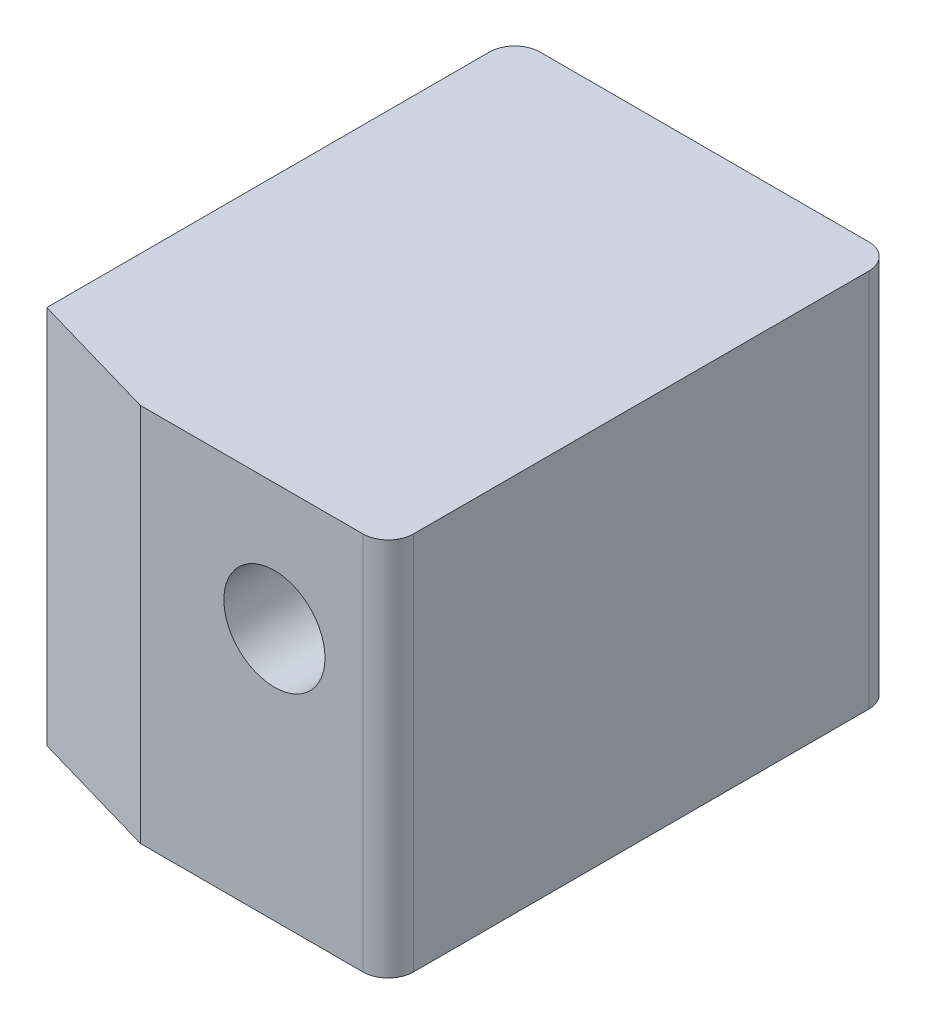
from build123d import *

# Parameters (mm, degrees)
BOSS_EXTRU_1_DEPTH      = 15
ESQUISSE2_R             = 2
ENL_V_MAT_EXTRU_1_DEPTH = 12
ESQUISSE3_R             = 2
ENL_V_MAT_EXTRU_2_DEPTH = 12
CONG_1_R                = 1
ENL_V_MAT_EXTRU_3_REACH = 28.101


with BuildPart() as part:
    # Esquisse1 → Boss.-Extru.1 (new body)
    with BuildSketch(Plane(origin=(0, 0, 0), x_dir=(1, 0, 0), z_dir=(0, 1, 0))):
        Polygon((0, 0), (7.5, 0), (7.5, 20), (-7.5, 20), (-7.5, 0), align=None)
    extrude(amount=BOSS_EXTRU_1_DEPTH)

    # Esquisse2 → Enlèv. mat.-Extru.1 (cut)
    with BuildSketch(Plane.XZ):
        with Locations(Location((3, -16, 0), (0, 0, 270))):
            Circle(ESQUISSE2_R)
        with Locations(Location((-3, -4, 0), (0, 0, 270))):
            Circle(ESQUISSE2_R)
    extrude(amount=-ENL_V_MAT_EXTRU_1_DEPTH, mode=Mode.SUBTRACT)

    # Esquisse3 → Enlèv. mat.-Extru.2 (cut)
    with BuildSketch(Plane.XY):
        with Locations((3, 10)):
            Circle(ESQUISSE3_R)
    extrude(amount=-ENL_V_MAT_EXTRU_2_DEPTH, mode=Mode.SUBTRACT)

    # Congé1
    cong_1_edges = [part.edges().sort_by_distance(p)[0] for p in [
        (-7.5, 7.5, -20),
        (7.5, 7.5, -20),
        (7.5, 7.5, 0),
    ]]
    fillet(cong_1_edges, radius=CONG_1_R)

    # Esquisse4 → Enlèv. mat.-Extru.3 (cut, up to next)
    with BuildSketch(Plane(origin=(0, 15, 0), x_dir=(1, 0, 0), z_dir=(0, 1, 0)), mode=Mode.PRIVATE) as enl_v_mat_extru_3_sk1:
        Polygon((-7.5, 0), (-2.3, 0), (-7.5, 1.5), align=None)
    enl_v_mat_extru_3_tool1 = extrude(enl_v_mat_extru_3_sk1.sketch, amount=-ENL_V_MAT_EXTRU_3_REACH, mode=Mode.PRIVATE) & part.part
    add(enl_v_mat_extru_3_tool1.solids().sort_by_distance((-5.766667, 15, -0.5))[0], mode=Mode.SUBTRACT)


solid = part.part
